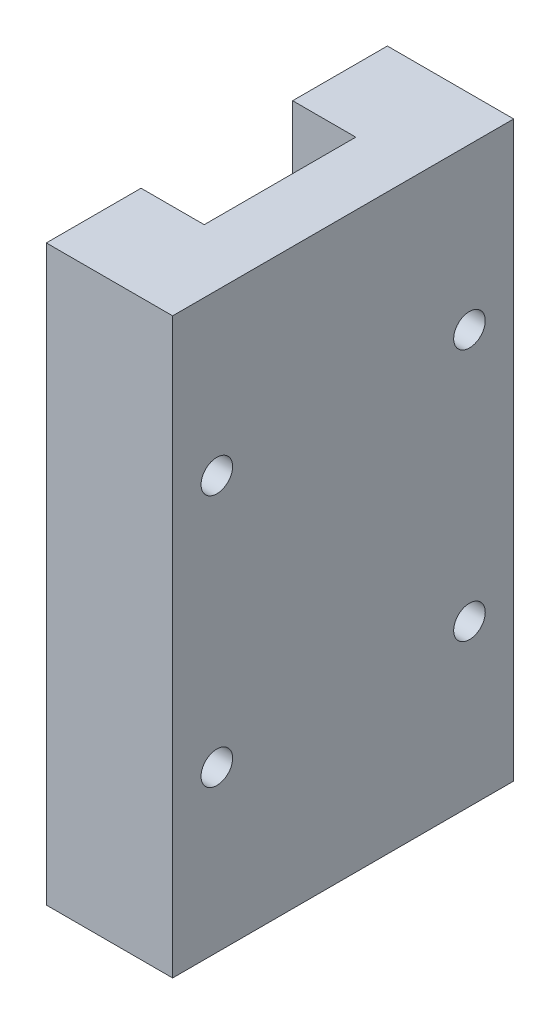
from build123d import *

# Parameters (mm, degrees)
SKETCH_1_W             = 27
SKETCH_1_H             = 45.4
EXTRUDE_1_DEPTH        = 10
SKETCH_2_W             = 5
SKETCH_2_H             = 12
CUT_EXTRUDE_1_DEPTH    = 49.408780195
HOLE_WIZARD_M3_1_D     = 2.5
HOLE_WIZARD_M3_1_DEPTH = 4.5
HOLE_WIZARD_M3_1_TIP   = 0.751075774


with BuildPart() as part:
    # 草圖1 → 伸長1 (new body)
    with BuildSketch(Plane(origin=(0, 0, 0), x_dir=(0, 0, -1), z_dir=(1, 0, 0))):
        Rectangle(SKETCH_1_W, SKETCH_1_H)
    extrude(amount=EXTRUDE_1_DEPTH)

    # 草圖2 → 除料-伸長1 (cut, through all)
    with BuildSketch(Plane.XZ.offset(22.7)):
        with Locations((2.5, 0)):
            Rectangle(SKETCH_2_W, SKETCH_2_H)
    extrude(amount=-CUT_EXTRUDE_1_DEPTH, mode=Mode.SUBTRACT)

    # M3 螺紋孔1
    with Locations(Plane(origin=(10, 10, -10), x_dir=(0, 0, 1), z_dir=(1, 0, 0))):
        with Locations((0, 0), (0, 20), (20, 0), (20, 20)):
            Hole(HOLE_WIZARD_M3_1_D / 2, depth=HOLE_WIZARD_M3_1_DEPTH)
            with Locations((0, 0, -(HOLE_WIZARD_M3_1_DEPTH + HOLE_WIZARD_M3_1_TIP / 2))):  # 118° drill point
                Cone(0, HOLE_WIZARD_M3_1_D / 2, HOLE_WIZARD_M3_1_TIP, mode=Mode.SUBTRACT)


solid = part.part
